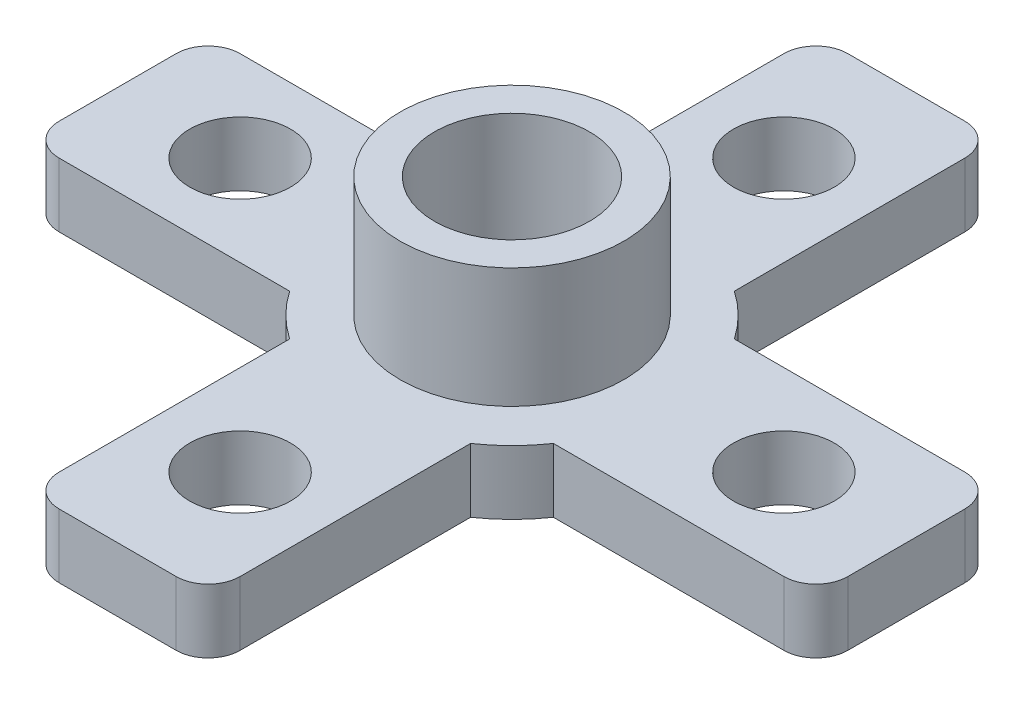
from build123d import *

# Parameters (mm, degrees)
SKETCH1_R             = 1.575
SKETCH1_R_2           = 3.5
BOSS_EXTRUDE1_DEPTH   = 2
SKETCH1_R_3           = 3
SKETCH1_R_4           = 1.125
BOSS_EXTRUDE1_2_DEPTH = 2
SKETCH1_3_R           = 3.5
SKETCH1_3_R_2         = 2.425
BOSS_EXTRUDE2_DEPTH   = 5.75
FILLET1_R             = 1
CUT_EXTRUDE1_DEPTH    = 1


with BuildPart() as part:
    # Sketch1 → Boss-Extrude1 (new body)
    with BuildSketch(Plane(origin=(0, 0, 0), x_dir=(1, 0, 0), z_dir=(0, 1, 0))):
        with BuildLine():
            ThreePointArc((-2.828427125, 4.123105626), (-3.535533906, 3.535533906), (-4.123105626, 2.828427125))
            Line((-4.123105626, 2.828427125), (-12.328427125, 2.828427125))
            Line((-12.328427125, 2.828427125), (-12.328427125, -2.828427125))
            Line((-12.328427125, -2.828427125), (-4.123105626, -2.828427125))
            ThreePointArc((-4.123105626, -2.828427125), (-3.535533906, -3.535533906), (-2.828427125, -4.123105626))
            Line((-2.828427125, -4.123105626), (-2.828427125, -12.328427125))
            Line((-2.828427125, -12.328427125), (2.828427125, -12.328427125))
            Line((2.828427125, -12.328427125), (2.828427125, -4.123105626))
            ThreePointArc((2.828427125, -4.123105626), (3.535533906, -3.535533906), (4.123105626, -2.828427125))
            Line((4.123105626, -2.828427125), (12.328427125, -2.828427125))
            Line((12.328427125, -2.828427125), (12.328427125, 2.828427125))
            Line((12.328427125, 2.828427125), (4.123105626, 2.828427125))
            ThreePointArc((4.123105626, 2.828427125), (3.535533906, 3.535533906), (2.828427125, 4.123105626))
            Line((2.828427125, 4.123105626), (2.828427125, 12.328427125))
            Line((2.828427125, 12.328427125), (-2.828427125, 12.328427125))
            Line((-2.828427125, 12.328427125), (-2.828427125, 4.123105626))
        make_face()
        with Locations(Location((0, -8.5, 0), (0, 0, 270))):
            Circle(SKETCH1_R, mode=Mode.SUBTRACT)
        with Locations(Location((0, 0, 0), (0, 0, 270))):
            Circle(SKETCH1_R_2, mode=Mode.SUBTRACT)
        with Locations(Location((0, 8.5, 0), (0, 0, 270))):
            Circle(SKETCH1_R, mode=Mode.SUBTRACT)
        with Locations(Location((8.5, 0, 0), (0, 0, 270))):
            Circle(SKETCH1_R, mode=Mode.SUBTRACT)
        with Locations(Location((-8.5, 0, 0), (0, 0, 270))):
            Circle(SKETCH1_R, mode=Mode.SUBTRACT)
    extrude(amount=BOSS_EXTRUDE1_DEPTH)

    # Sketch1<3> → Boss-Extrude2 (add)
    with BuildSketch(Plane(origin=(0, 0, 0), x_dir=(1, 0, 0), z_dir=(0, 1, 0))):
        with Locations(Location((0, 0, 0), (0, 0, 270))):
            Circle(SKETCH1_3_R)
        with Locations(Location((0, 0, 0), (0, 0, 270))):
            Circle(SKETCH1_3_R_2, mode=Mode.SUBTRACT)
    extrude(amount=BOSS_EXTRUDE2_DEPTH)

    # Fillet1
    fillet1_edges = [part.edges().sort_by_distance(p)[0] for p in [
        (-2.828427125, 1, -12.328427125),
        (2.828427125, 1, -12.328427125),
        (12.328427125, 1, -2.828427125),
        (12.328427125, 1, 2.828427125),
        (2.828427125, 1, 12.328427125),
        (-2.828427125, 1, 12.328427125),
        (-12.328427125, 1, 2.828427125),
        (-12.328427125, 1, -2.828427125),
    ]]
    fillet(fillet1_edges, radius=FILLET1_R)


with BuildPart() as body_2:
    # Sketch1 → Boss-Extrude1 2 (new body)
    with BuildSketch(Plane(origin=(0, 0, 0), x_dir=(1, 0, 0), z_dir=(0, 1, 0))):
        with Locations(Location((0, 0, 0), (0, 0, 270))):
            Circle(SKETCH1_R_3)
        with Locations(Location((0, 0, 0), (0, 0, 270))):
            Circle(SKETCH1_R_4, mode=Mode.SUBTRACT)
    extrude(amount=BOSS_EXTRUDE1_2_DEPTH)


with BuildPart() as cut_extrude1_tool:
    # Sketch1<4> → Cut-Extrude1 (new body)
    with BuildSketch(Plane(origin=(0, 0, 0), x_dir=(1, 0, 0), z_dir=(0, 1, 0))):
        with BuildLine():
            Line((1.714733944, 1.714733944), (2.121320344, 2.121320344))
            ThreePointArc((2.121320344, 2.121320344), (1.148050297, 2.771638598), (0, 3))
            Line((0, 3), (0, 2.425))
            ThreePointArc((0, 2.425), (0.928007323, 2.240407866), (1.714733944, 1.714733944))
        make_face()
        with BuildLine():
            ThreePointArc((3, 0), (2.771638598, 1.148050297), (2.121320344, 2.121320344))
            Line((2.121320344, 2.121320344), (1.714733944, 1.714733944))
            ThreePointArc((1.714733944, 1.714733944), (2.240407866, 0.928007323), (2.425, 0))
            ThreePointArc((2.425, 0), (2.240407866, -0.928007323), (1.714733944, -1.714733944))
            Line((1.714733944, -1.714733944), (2.121320344, -2.121320344))
            ThreePointArc((2.121320344, -2.121320344), (2.771638598, -1.148050297), (3, 0))
        make_face()
        with BuildLine():
            ThreePointArc((-2.121320344, -2.121320344), (0, -3), (2.121320344, -2.121320344))
            Line((2.121320344, -2.121320344), (1.714733944, -1.714733944))
            ThreePointArc((1.714733944, -1.714733944), (0, -2.425), (-1.714733944, -1.714733944))
            Line((-1.714733944, -1.714733944), (-2.121320344, -2.121320344))
        make_face()
        with BuildLine():
            Line((-1.714733944, 1.714733944), (-2.121320344, 2.121320344))
            ThreePointArc((-2.121320344, 2.121320344), (-3, 0), (-2.121320344, -2.121320344))
            Line((-2.121320344, -2.121320344), (-1.714733944, -1.714733944))
            ThreePointArc((-1.714733944, -1.714733944), (-2.425, 0), (-1.714733944, 1.714733944))
        make_face()
        with BuildLine():
            ThreePointArc((2.425, 0), (2.240407866, 0.928007323), (1.714733944, 1.714733944))
            Line((1.714733944, 1.714733944), (0.795495129, 0.795495129))
            ThreePointArc((0.795495129, 0.795495129), (1.039364474, 0.430518861), (1.125, 0))
            ThreePointArc((1.125, 0), (1.039364474, -0.430518861), (0.795495129, -0.795495129))
            Line((0.795495129, -0.795495129), (1.714733944, -1.714733944))
            ThreePointArc((1.714733944, -1.714733944), (2.240407866, -0.928007323), (2.425, 0))
        make_face()
        with BuildLine():
            ThreePointArc((-1.714733944, -1.714733944), (0, -2.425), (1.714733944, -1.714733944))
            Line((1.714733944, -1.714733944), (0.795495129, -0.795495129))
            ThreePointArc((0.795495129, -0.795495129), (0, -1.125), (-0.795495129, -0.795495129))
            Line((-0.795495129, -0.795495129), (-1.714733944, -1.714733944))
        make_face()
        with BuildLine():
            Line((-0.795495129, 0.795495129), (-1.714733944, 1.714733944))
            ThreePointArc((-1.714733944, 1.714733944), (-2.425, 0), (-1.714733944, -1.714733944))
            Line((-1.714733944, -1.714733944), (-0.795495129, -0.795495129))
            ThreePointArc((-0.795495129, -0.795495129), (-1.125, 0), (-0.795495129, 0.795495129))
        make_face()
        with BuildLine():
            Line((0.795495129, 0.795495129), (1.714733944, 1.714733944))
            ThreePointArc((1.714733944, 1.714733944), (0.928007323, 2.240407866), (0, 2.425))
            Line((0, 2.425), (0, 1.125))
            ThreePointArc((0, 1.125), (0.430518861, 1.039364474), (0.795495129, 0.795495129))
        make_face()
        with BuildLine():
            Line((0, 1.125), (0, 2.425))
            ThreePointArc((0, 2.425), (-0.928007323, 2.240407866), (-1.714733944, 1.714733944))
            Line((-1.714733944, 1.714733944), (-0.795495129, 0.795495129))
            ThreePointArc((-0.795495129, 0.795495129), (-0.430518861, 1.039364474), (0, 1.125))
        make_face()
        with BuildLine():
            Line((0, 2.425), (0, 3))
            ThreePointArc((0, 3), (-1.148050297, 2.771638598), (-2.121320344, 2.121320344))
            Line((-2.121320344, 2.121320344), (-1.714733944, 1.714733944))
            ThreePointArc((-1.714733944, 1.714733944), (-0.928007323, 2.240407866), (0, 2.425))
        make_face()
    extrude(amount=CUT_EXTRUDE1_DEPTH)


with BuildPart() as part_1:
    add(part.part)

    # Cut-Extrude1: cut by cut_extrude1_tool
    add(cut_extrude1_tool.part, mode=Mode.SUBTRACT)


with BuildPart() as body_2_1:
    add(body_2.part)

    # Cut-Extrude1: cut by cut_extrude1_tool
    add(cut_extrude1_tool.part, mode=Mode.SUBTRACT)


solid = Compound([part_1.part, body_2_1.part])
